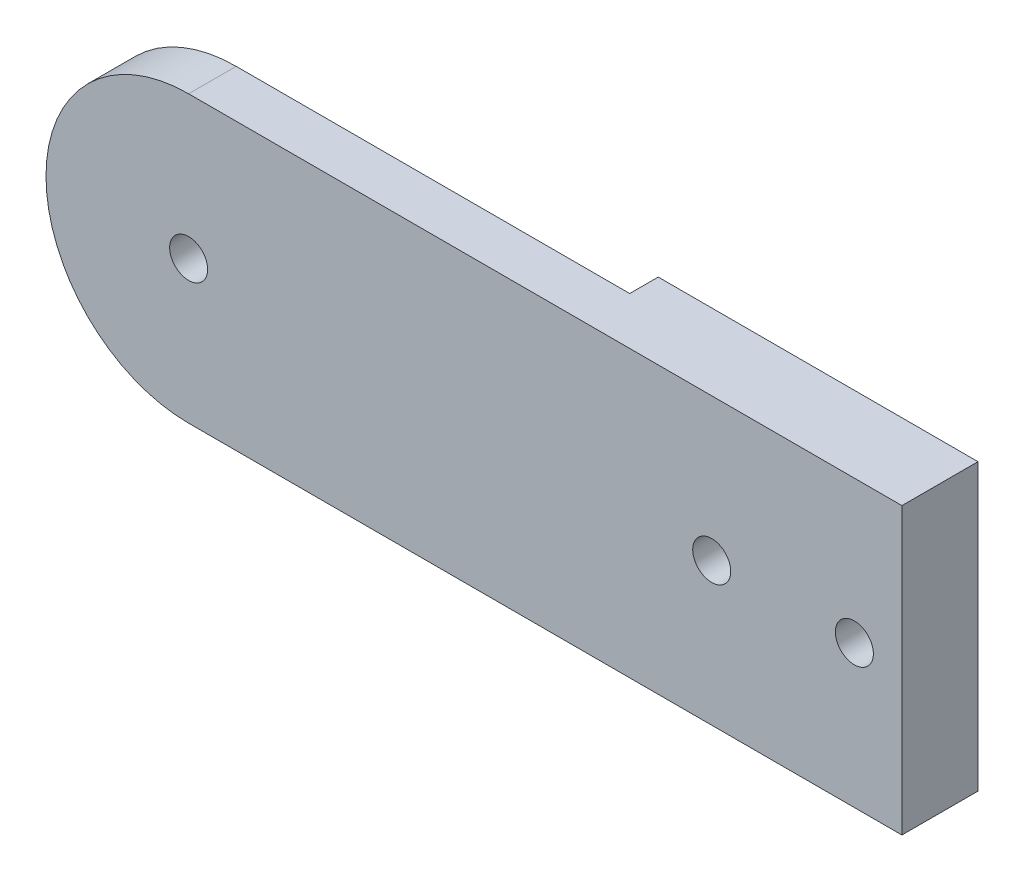
from build123d import *

# Parameters (mm, degrees)
BOSS_EXTRUDE2_DEPTH = 5
SKETCH3_R           = 2
CUT_EXTRUDE1_DEPTH  = 48.696960071
SKETCH5_W           = 33.623135457
SKETCH5_H           = 30
BOSS_EXTRUDE3_DEPTH = 3
SKETCH6_R           = 2
CUT_EXTRUDE2_DEPTH  = 3
SKETCH7_R           = 2
CUT_EXTRUDE3_DEPTH  = 49.104053883


with BuildPart() as part:
    # Sketch1 → Boss-Extrude2 (new body)
    with BuildSketch(Plane.XY):
        with BuildLine():
            Line((-30, 15), (45, 15))
            Line((45, 15), (45, -15))
            Line((45, -15), (-30, -15))
            ThreePointArc((-30, -15), (-45, 0), (-30, 15))
        make_face()
    extrude(amount=BOSS_EXTRUDE2_DEPTH)

    # Sketch3 → Cut-Extrude1 (cut, through all)
    with BuildSketch(Plane(origin=(0, 0, 0), x_dir=(-1, 0, 0), z_dir=(0, 0, -1))):
        with Locations((-40, 0)):
            Circle(SKETCH3_R)
        with Locations((-25, 0)):
            Circle(SKETCH3_R)
    extrude(amount=-CUT_EXTRUDE1_DEPTH, mode=Mode.SUBTRACT)

    # Sketch5 → Boss-Extrude3 (add)
    with BuildSketch(Plane(origin=(0, 0, 0), x_dir=(-1, 0, 0), z_dir=(0, 0, -1))):
        with Locations((-28.188432271, 0)):
            Rectangle(SKETCH5_W, SKETCH5_H)
    extrude(amount=BOSS_EXTRUDE3_DEPTH)

    # Sketch6 → Cut-Extrude2 (cut)
    with BuildSketch(Plane(origin=(0, 0, -3), x_dir=(-1, 0, 0), z_dir=(0, 0, -1))):
        with Locations((-40, 0)):
            Circle(SKETCH6_R)
        with Locations((-25, 0)):
            Circle(SKETCH6_R)
    extrude(amount=-CUT_EXTRUDE2_DEPTH, mode=Mode.SUBTRACT)

    # Sketch7 → Cut-Extrude3 (cut, through all)
    with BuildSketch(Plane.XY.offset(5)):
        with Locations((-30, 0)):
            Circle(SKETCH7_R)
    extrude(amount=-CUT_EXTRUDE3_DEPTH, mode=Mode.SUBTRACT)


solid = part.part
